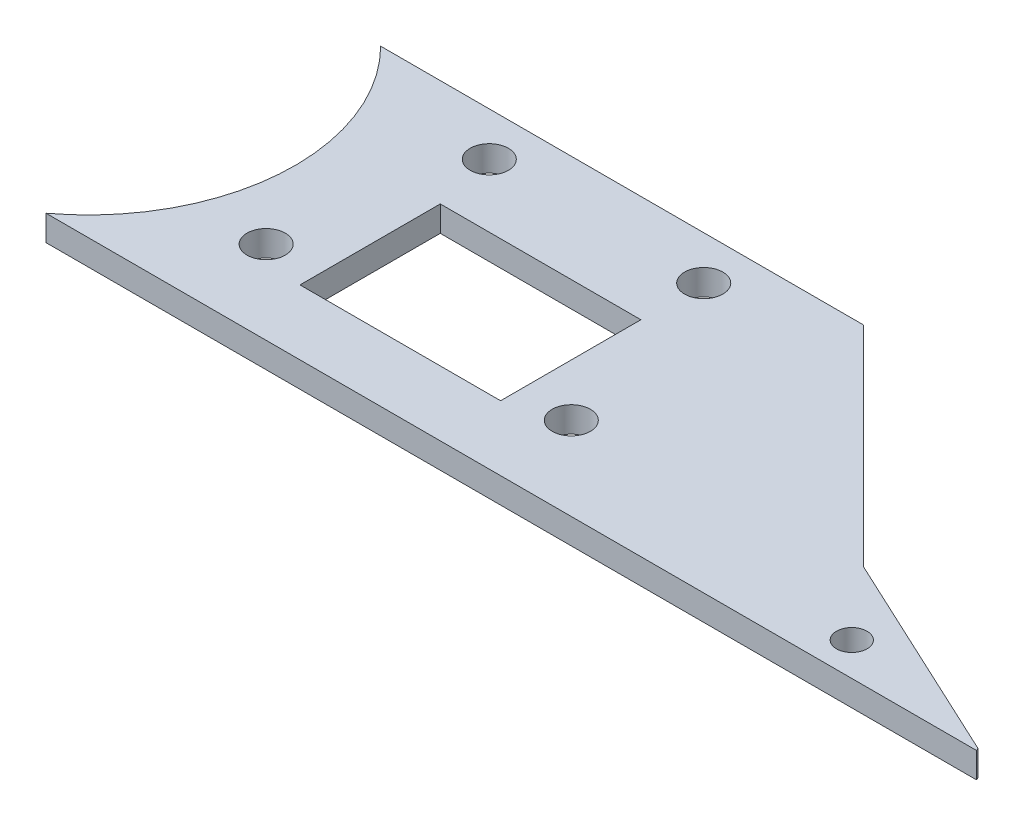
from build123d import *

# Parameters (mm, degrees)
SKETCH_1_R               = 1.5
SKETCH_1_W               = 15.730611704
SKETCH_1_H               = 11
EXTRUDE_1_DEPTH          = 2
CUT_EXTRUDE_1_DEPTH      = 106.5
CUT_EXTRUDE_1_DEPTH_BACK = 62.743635726
SKETCH_7_R               = 1.2
CUT_EXTRUDE_5_DEPTH      = 15


with BuildPart() as part:
    # Эскиз1 → Бобышка-Вытянуть1 (new body)
    with BuildSketch(Plane(origin=(0, 0, 0), x_dir=(1, 0, 0), z_dir=(0, 1, 0))):
        with BuildLine():
            Line((-56.923759365, -23.831956958), (16.382902061, -23.831956958))
            Line((16.382902061, -23.831956958), (-0.836945892, -15.802209985))
            Line((-0.836945892, -15.802209985), (-17.271974735, 0.632818857))
            Line((-17.271974735, 0.632818857), (-55.146365247, 0.632818857))
            ThreePointArc((-55.146365247, 0.632818857), (-50.679018006, -7.808361393), (-51.74094673, -17.29956905))
            ThreePointArc((-51.74094673, -17.29956905), (-53.905020217, -20.904809923), (-56.923759365, -23.831956958))
        make_face()
        with Locations((-43.205666325, -2.789799404)):
            Circle(SKETCH_1_R, mode=Mode.SUBTRACT)
        with Locations((-26.393046621, -2.789799404)):
            Circle(SKETCH_1_R, mode=Mode.SUBTRACT)
        with Locations((-46.193307824, -17.29956905)):
            Circle(SKETCH_1_R, mode=Mode.SUBTRACT)
        with Locations((-22.266173528, -17.29956905)):
            Circle(SKETCH_1_R, mode=Mode.SUBTRACT)
        with Locations((-34.23147938, -13.242579452)):
            Rectangle(SKETCH_1_W, SKETCH_1_H, mode=Mode.SUBTRACT)
    extrude(amount=EXTRUDE_1_DEPTH)

    # Эскиз2 → Вырез-Вытянуть1 (cut, two sides: drawn at the far end of the back side and taken through both)
    with BuildSketch(Plane(origin=(0, 2, 0), x_dir=(1, 0, 0), z_dir=(0, 1, 0)).offset(-CUT_EXTRUDE_1_DEPTH_BACK)):
        Polygon((16.382902061, -23.831956958), (15.960145161, -23.634822178), (16.059019052, -23.90647596), align=None)
    extrude(amount=CUT_EXTRUDE_1_DEPTH + CUT_EXTRUDE_1_DEPTH_BACK, mode=Mode.SUBTRACT)

    # Эскиз7 → Вырез-Вытянуть5 (cut)
    with BuildSketch(Plane.XZ):
        with Locations((3.651057562, 21.224691708)):
            Circle(SKETCH_7_R)
    extrude(amount=-CUT_EXTRUDE_5_DEPTH, mode=Mode.SUBTRACT)


solid = part.part
